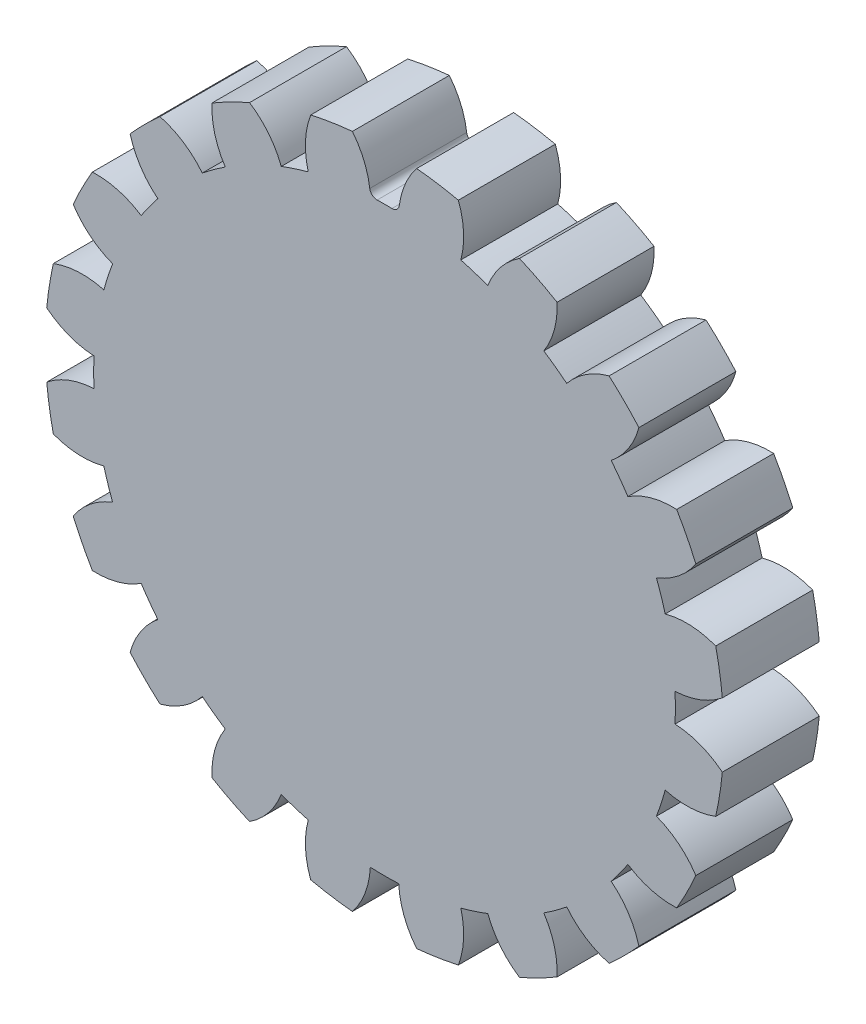
from build123d import *

# Parameters (mm, degrees)
SKETCH1_R           = 17.5
BOSS_EXTRUDE1_DEPTH = 2.5
CUT_EXTRUDE1_DEPTH  = 25.874685928
FILLET2_R           = 0.375
CIRPATTERN1_COUNT   = 20


with BuildPart() as part:
    # Sketch1 → Boss-Extrude1 (new, symmetric)
    with BuildSketch(Plane.XY):
        Circle(SKETCH1_R)
    extrude(amount=BOSS_EXTRUDE1_DEPTH, both=True)

    # Sketch3 → Cut-Extrude1 (cut, symmetric)
    with BuildSketch(Plane.XY):
        with BuildLine():
            ThreePointArc((-2.639096151, 18.310793852), (-1.2854332, 16.875635392), (-0.731537344, 14.982151151))
            ThreePointArc((-0.731537344, 14.982151151), (0, 15), (0.731537344, 14.982151151))
            ThreePointArc((0.731537344, 14.982151151), (1.2854332, 16.875635392), (2.639096151, 18.310793852))
            ThreePointArc((2.639096151, 18.310793852), (0, 18.5), (-2.639096151, 18.310793852))
        make_face()
    cut_extrude1 = extrude(amount=CUT_EXTRUDE1_DEPTH, both=True, mode=Mode.SUBTRACT)

    # Fillet2
    fillet2_edges = [part.edges().sort_by_distance(p)[0] for p in [
        (-0.731537344, 14.982151151, 0),
        (0.731537344, 14.982151151, 0),
    ]]
    fillet(fillet2_edges, radius=FILLET2_R)

    # CirPattern1: Cut-Extrude1 ×20 about axis
    cirpattern1_axis = Axis((0, 0, 0), (0, 0, 1))
    for i in range(1, CIRPATTERN1_COUNT):
        add(cut_extrude1.rotate(cirpattern1_axis, i * 360 / CIRPATTERN1_COUNT), mode=Mode.SUBTRACT)


solid = part.part
